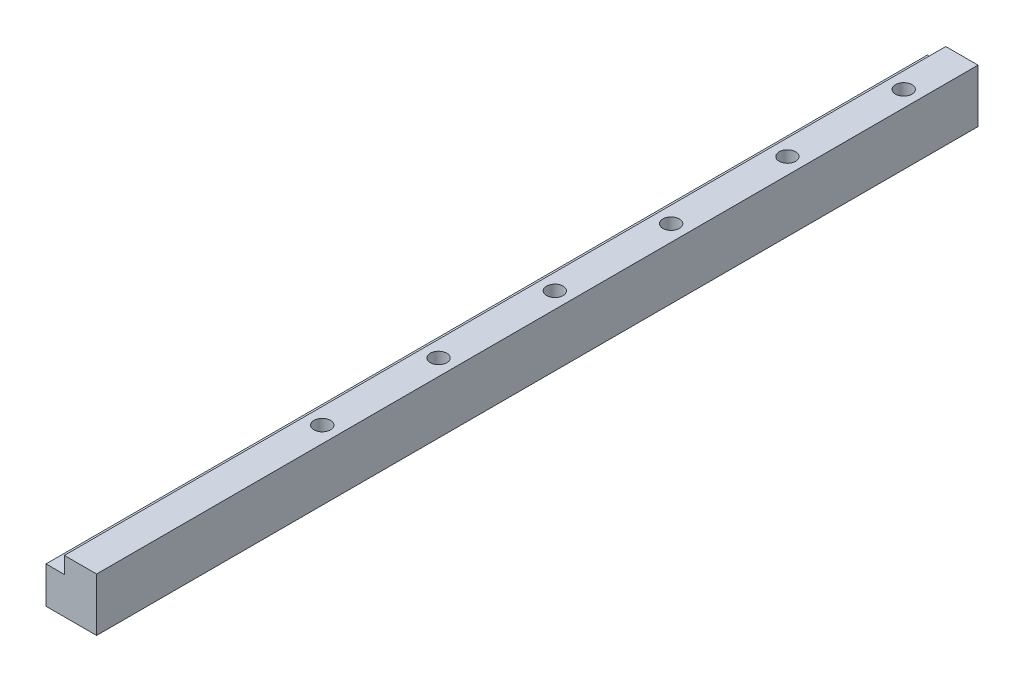
from build123d import *

# Parameters (mm, degrees)
BOSS_EXTRU_1_DEPTH              = 100
DIAM_TRE_DU_PER_AGE_4_5_4_5_1_D = 4.5
BOSS_EXTRU_2_DEPTH              = 40


with BuildPart() as part:
    # Esquisse1 → Boss.-Extru.1 (new, symmetric)
    with BuildSketch(Plane.XY):
        Polygon((-13.777077185, 10), (-8.777077185, 10), (-8.777077185, 14.5), (0, 14.5), (0, 0), (-13.777077185, 0), align=None)
    extrude(amount=BOSS_EXTRU_1_DEPTH, both=True)

    # Diamètre du perçage Ø4.5 (4.5)1 (through all)
    with Locations(Plane(origin=(0, 14.5, 0), x_dir=(1, 0, 0), z_dir=(0, 1, 0))):
        with Locations((-4.388538592, -74.166666667), (-4.388538592, 84.166666667), (-4.388538592, 52.5), (-4.388538592, 20.833333333), (-4.388538592, -10.833333333), (-4.388538592, -42.5)):
            Hole(DIAM_TRE_DU_PER_AGE_4_5_4_5_1_D / 2)

    # Esquisse4 → Boss.-Extru.2 (add)
    with BuildSketch(Plane.XY.offset(100)):
        Polygon((-13.777077185, 10), (-13.777077185, 0), (0, 0), (0, 14.5), (-8.777077185, 14.5), (-8.777077185, 10), align=None)
    extrude(amount=BOSS_EXTRU_2_DEPTH)


solid = part.part
